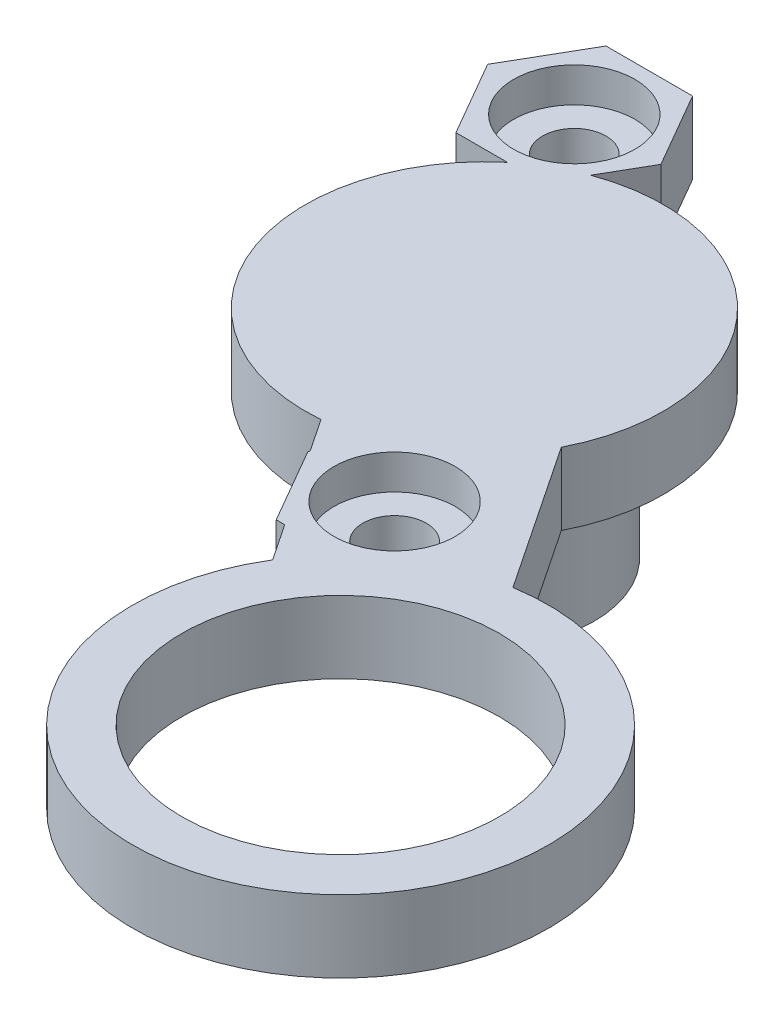
from build123d import *

# Parameters (mm, degrees)
RETAINER_FEATURE_1_PROFILE_R  = 3.8
RETAINER_FEATURE_1_DEPTH      = 5.02
RETAINER_FEATURE_2_PROFILE_R  = 6.2
RETAINER_FEATURE_2_DEPTH      = 2.5
RETAINER_FEATURE_5_DEPTH      = 2.5
RETAINER_FEATURE_8_DEPTH      = 2.5
RETAINER_FEATURE_12_DEPTH     = 2.5
RETAINER_FEATURE_13_PROFILE_R = 7.2
RETAINER_FEATURE_13_DEPTH     = 2.5
RETAINER_FEATURE_14_PROFILE_R = 5.5
RETAINER_FEATURE_14_DEPTH     = 2.7
RETAINER_FEATURE_15_PROFILE_R = 1.1
RETAINER_FEATURE_15_DEPTH     = 3.75
RETAINER_FEATURE_16_PROFILE_R = 2.1
RETAINER_FEATURE_16_DEPTH     = 1.45
RETAINER_FEATURE_17_PROFILE_R = 1.1
RETAINER_FEATURE_17_DEPTH     = 3.75
RETAINER_FEATURE_18_PROFILE_R = 2.1
RETAINER_FEATURE_18_DEPTH     = 1.45


with BuildPart() as part:
    # Retainer Feature 1 profile → Retainer Feature 1 (new body)
    with BuildSketch(Plane(origin=(0, -101, 0), x_dir=(-1, 0, 0), z_dir=(0, -1, 0))):
        with Locations(Location((30.310889132, 15, 0), (0, 0, 90))):
            Circle(RETAINER_FEATURE_1_PROFILE_R)
    extrude(amount=RETAINER_FEATURE_1_DEPTH)

    # Retainer Feature 2 profile → Retainer Feature 2 (add)
    with BuildSketch(Plane(origin=(0, -106, 0), x_dir=(-1, 0, 0), z_dir=(0, -1, 0))):
        with Locations(Location((30.310889132, 15, 0), (0, 0, 90))):
            Circle(RETAINER_FEATURE_2_PROFILE_R)
    extrude(amount=RETAINER_FEATURE_2_DEPTH)

    # Middle Right Floating Compression Ball R → Retainer Feature 5 (add)
    with BuildSketch(Plane(origin=(0, -106, 0), x_dir=(-1, 0, 0), z_dir=(0, -1, 0))):
        Polygon((31.560889132, 22.361215932), (33.060889132, 19.763139721), (36.060889132, 19.763139721), (37.560889132, 22.361215932), (36.060889132, 24.959292144), (33.060889132, 24.959292144), align=None)
    extrude(amount=RETAINER_FEATURE_5_DEPTH)

    # Middle Right Floating Compression Ba 2 → Retainer Feature 8 (add)
    with BuildSketch(Plane(origin=(0, -106, 0), x_dir=(-1, 0, 0), z_dir=(0, -1, 0))):
        Polygon((23.060889132, 7.638784068), (24.560889132, 5.040707856), (27.560889132, 5.040707856), (29.060889132, 7.638784068), (27.560889132, 10.236860279), (24.560889132, 10.236860279), align=None)
    extrude(amount=RETAINER_FEATURE_8_DEPTH)

    # Retainer Feature 9 profile → Retainer Feature 9 (revolve, cut)
    with BuildSketch(Plane(origin=(0, -101, 0), x_dir=(-1, 0, 0), z_dir=(0, -1, 0))):
        with BuildLine():
            Line((30.310889132, 11.85), (30.310889132, 18.15))
            ThreePointArc((30.310889132, 18.15), (27.160889132, 15), (30.310889132, 11.85))
        make_face()
    revolve(axis=Axis((-30.310889132, -101, -25), (0, 0, 1)), mode=Mode.SUBTRACT)

    # Middle Right Floating Compression Ba 3 → Retainer Feature 12 (add)
    with BuildSketch(Plane(origin=(0, -106, 0), x_dir=(-1, 0, 0), z_dir=(0, -1, 0))):
        Polygon((27.816215917, 16.66631496), (17.79697803, 1.66631496), (22.786324462, -1.66631496), (32.805562348, 13.33368504), align=None)
    extrude(amount=RETAINER_FEATURE_12_DEPTH)

    # Retainer Feature 13 profile → Retainer Feature 13 (add)
    with BuildSketch(Plane(origin=(0, -106, 0), x_dir=(-1, 0, 0), z_dir=(0, -1, 0))):
        with Locations((20.291651246, 0)):
            Circle(RETAINER_FEATURE_13_PROFILE_R)
    extrude(amount=RETAINER_FEATURE_13_DEPTH)

    # Retainer Feature 14 profile → Retainer Feature 14 (cut)
    with BuildSketch(Plane(origin=(0, -105.9, 0), x_dir=(-1, 0, 0), z_dir=(0, -1, 0))):
        with Locations(Location((20.291651246, 0, 0), (0, 0, 270))):
            Circle(RETAINER_FEATURE_14_PROFILE_R)
    extrude(amount=RETAINER_FEATURE_14_DEPTH, mode=Mode.SUBTRACT)

    # Retainer Feature 15 profile → Retainer Feature 15 (cut)
    with BuildSketch(Plane(origin=(0, -105, 0), x_dir=(-1, 0, 0), z_dir=(0, -1, 0))):
        with Locations(Location((34.560889132, 22.361215932, 0), (0, 0, 90))):
            Circle(RETAINER_FEATURE_15_PROFILE_R)
    extrude(amount=RETAINER_FEATURE_15_DEPTH, mode=Mode.SUBTRACT)

    # Retainer Feature 16 profile → Retainer Feature 16 (cut)
    with BuildSketch(Plane(origin=(0, -107.3, 0), x_dir=(-1, 0, 0), z_dir=(0, -1, 0))):
        with Locations(Location((34.560889132, 22.361215932, 0), (0, 0, 90))):
            Circle(RETAINER_FEATURE_16_PROFILE_R)
    extrude(amount=RETAINER_FEATURE_16_DEPTH, mode=Mode.SUBTRACT)

    # Retainer Feature 17 profile → Retainer Feature 17 (cut)
    with BuildSketch(Plane(origin=(0, -105, 0), x_dir=(-1, 0, 0), z_dir=(0, -1, 0))):
        with Locations(Location((26.060889132, 7.638784068, 0), (0, 0, 90))):
            Circle(RETAINER_FEATURE_17_PROFILE_R)
    extrude(amount=RETAINER_FEATURE_17_DEPTH, mode=Mode.SUBTRACT)

    # Retainer Feature 18 profile → Retainer Feature 18 (cut)
    with BuildSketch(Plane(origin=(0, -107.3, 0), x_dir=(-1, 0, 0), z_dir=(0, -1, 0))):
        with Locations(Location((26.060889132, 7.638784068, 0), (0, 0, 90))):
            Circle(RETAINER_FEATURE_18_PROFILE_R)
    extrude(amount=RETAINER_FEATURE_18_DEPTH, mode=Mode.SUBTRACT)

    # Articulation Throat Sketch → Articulation Throat (revolve, cut)
    with BuildSketch(Plane(origin=(-55.559435073, -21.315405316, -26.260716517), x_dir=(0.37694407644157146, 0.1446147852349051, -0.9148768917876727), z_dir=(0.8541721659092646, 0.32770358269776195, 0.4037329227012915))):
        Polygon((-12.308450042, -83.441173866), (-10.724100051, -81.773890115), (-22.767880189, -61.059022025), (-28.981287547, -67.597673951), align=None)
    revolve(axis=Axis((-25.110986143, -106.383086561, -21.631997284), (-0.5199902989343897, 0.5383086561091633, 0.6631997284167648)), mode=Mode.SUBTRACT)


with BuildPart() as body_2:
    # Mirror1: mirrored copy
    add(part.part.mirror(Plane(origin=(0, 0, 0), x_dir=(0, 0, 1), z_dir=(0, -1, 0))))


solid = body_2.part
